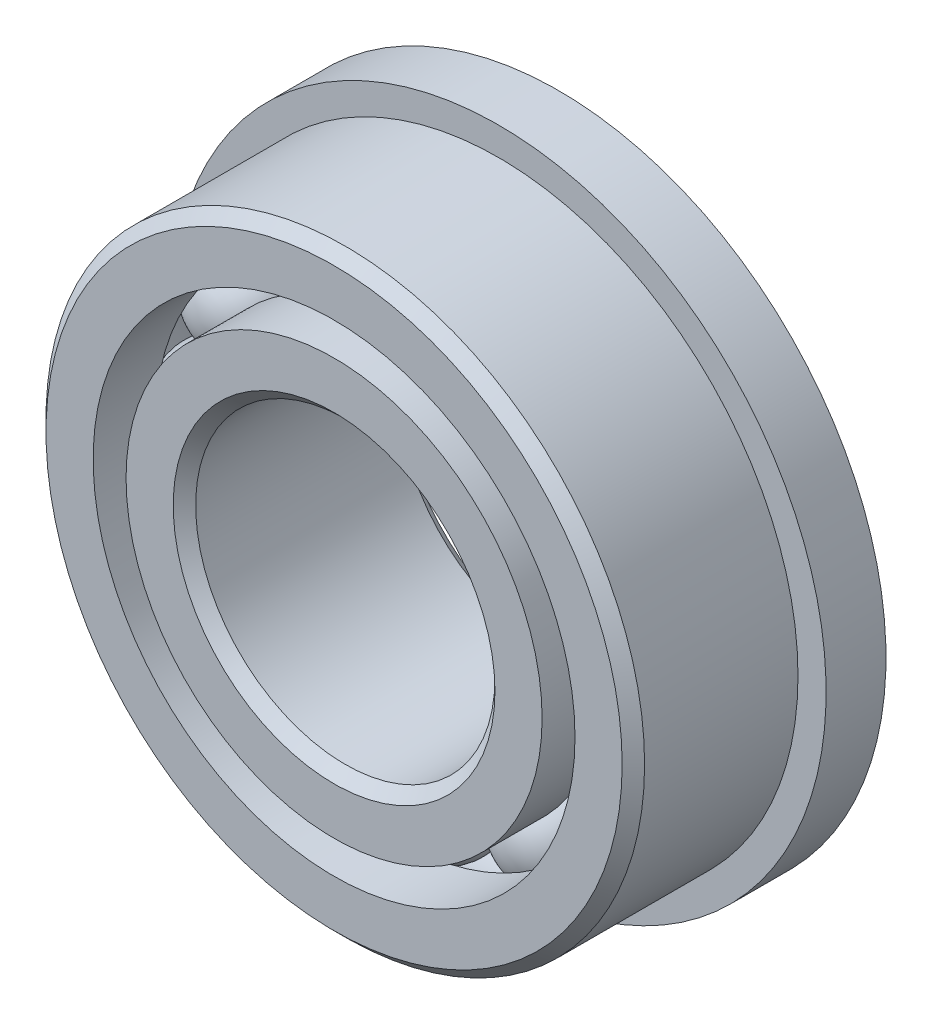
from build123d import *

# Parameters (mm, degrees)
SKETCH5_W         = 1.27
SKETCH5_H         = 1.335261951
CIRPATTERN1_COUNT = 12


with BuildPart() as part:
    # Sketch1 → Revolve1 (revolve)
    with BuildSketch(Plane(origin=(0, 0, 0), x_dir=(0, 0, -1), z_dir=(1, 0, 0)), mode=Mode.PRIVATE) as revolve1_sk:
        with BuildLine():
            Line((2.143125, 6.35), (-2.143125, 6.35))
            Line((-2.143125, 6.35), (-2.38125, 6.111875))
            Line((-2.38125, 6.111875), (-2.38125, 5.111401099))
            Line((-2.38125, 5.111401099), (-1.058333333, 5.111401099))
            ThreePointArc((-1.058333333, 5.111401099), (0, 5.876861441), (1.058333333, 5.111401099))
            Line((1.058333333, 5.111401099), (2.38125, 5.111401099))
            Line((2.38125, 5.111401099), (2.38125, 6.111875))
            Line((2.38125, 6.111875), (2.143125, 6.35))
        make_face()
    revolve(revolve1_sk.sketch.rotate(Axis((0, 0, 2.38125), (0, 0, -1)), 90), axis=Axis((0, 0, 2.38125), (0, 0, -1)))

    # Sketch5 → Revolve5 (revolve)
    with BuildSketch(Plane(origin=(0, 0, 0), x_dir=(0, 0, -1), z_dir=(1, 0, 0)), mode=Mode.PRIVATE) as revolve5_sk:
        with Locations((1.74625, 6.279269025)):
            Rectangle(SKETCH5_W, SKETCH5_H)
    revolve(revolve5_sk.sketch.rotate(Axis((0, 0, -2.38125), (0, 0, 1)), 270), axis=Axis((0, 0, -2.38125), (0, 0, 1)))


with BuildPart() as body_2:
    # Sketch3 → Revolve3 (revolve)
    with BuildSketch(Plane(origin=(0, 0, 0), x_dir=(0, 0, -1), z_dir=(1, 0, 0)), mode=Mode.PRIVATE) as revolve3_sk:
        with BuildLine():
            Line((-1.058333333, 4.413598901), (-2.38125, 4.413598901))
            Line((-2.38125, 4.413598901), (-2.38125, 3.413125))
            Line((-2.38125, 3.413125), (-2.143125, 3.175))
            Line((-2.143125, 3.175), (2.143125, 3.175))
            Line((2.143125, 3.175), (2.38125, 3.413125))
            Line((2.38125, 3.413125), (2.38125, 4.413598901))
            Line((2.38125, 4.413598901), (1.058333333, 4.413598901))
            ThreePointArc((1.058333333, 4.413598901), (0, 3.648138559), (-1.058333333, 4.413598901))
        make_face()
    revolve(revolve3_sk.sketch.rotate(Axis((0, 0, 2.38125), (0, 0, -1)), 90), axis=Axis((0, 0, 2.38125), (0, 0, -1)))


with BuildPart() as body_3:
    # Sketch4 → Revolve4 (revolve)
    with BuildSketch(Plane(origin=(0, 0, 0), x_dir=(0, 0, -1), z_dir=(1, 0, 0))):
        with BuildLine():
            Line((-1.114361441, 4.7625), (1.114361441, 4.7625))
            ThreePointArc((1.114361441, 4.7625), (0, 5.876861441), (-1.114361441, 4.7625))
        make_face()
    revolve(axis=Axis((0, 4.7625, 1.114361441), (0, 0, -1)))


with BuildPart() as cirpattern1_1:
    # CirPattern1: pattern copy
    add(body_3.part.rotate(Axis((0, 0, 0), (0, 0, 1)), 1 * 360 / CIRPATTERN1_COUNT))


with BuildPart() as cirpattern1_2:
    # CirPattern1: pattern copy
    add(body_3.part.rotate(Axis((0, 0, 0), (0, 0, 1)), 2 * 360 / CIRPATTERN1_COUNT))


with BuildPart() as cirpattern1_3:
    # CirPattern1: pattern copy
    add(body_3.part.rotate(Axis((0, 0, 0), (0, 0, 1)), 3 * 360 / CIRPATTERN1_COUNT))


with BuildPart() as cirpattern1_4:
    # CirPattern1: pattern copy
    add(body_3.part.rotate(Axis((0, 0, 0), (0, 0, 1)), 4 * 360 / CIRPATTERN1_COUNT))


with BuildPart() as cirpattern1_5:
    # CirPattern1: pattern copy
    add(body_3.part.rotate(Axis((0, 0, 0), (0, 0, 1)), 5 * 360 / CIRPATTERN1_COUNT))


with BuildPart() as cirpattern1_6:
    # CirPattern1: pattern copy
    add(body_3.part.rotate(Axis((0, 0, 0), (0, 0, 1)), 6 * 360 / CIRPATTERN1_COUNT))


with BuildPart() as cirpattern1_7:
    # CirPattern1: pattern copy
    add(body_3.part.rotate(Axis((0, 0, 0), (0, 0, 1)), 7 * 360 / CIRPATTERN1_COUNT))


with BuildPart() as cirpattern1_8:
    # CirPattern1: pattern copy
    add(body_3.part.rotate(Axis((0, 0, 0), (0, 0, 1)), 8 * 360 / CIRPATTERN1_COUNT))


with BuildPart() as cirpattern1_9:
    # CirPattern1: pattern copy
    add(body_3.part.rotate(Axis((0, 0, 0), (0, 0, 1)), 9 * 360 / CIRPATTERN1_COUNT))


with BuildPart() as cirpattern1_10:
    # CirPattern1: pattern copy
    add(body_3.part.rotate(Axis((0, 0, 0), (0, 0, 1)), 10 * 360 / CIRPATTERN1_COUNT))


with BuildPart() as cirpattern1_11:
    # CirPattern1: pattern copy
    add(body_3.part.rotate(Axis((0, 0, 0), (0, 0, 1)), 11 * 360 / CIRPATTERN1_COUNT))


solid = Compound([part.part, body_2.part, body_3.part, cirpattern1_1.part, cirpattern1_2.part, cirpattern1_3.part, cirpattern1_4.part, cirpattern1_5.part, cirpattern1_6.part, cirpattern1_7.part, cirpattern1_8.part, cirpattern1_9.part, cirpattern1_10.part, cirpattern1_11.part])
